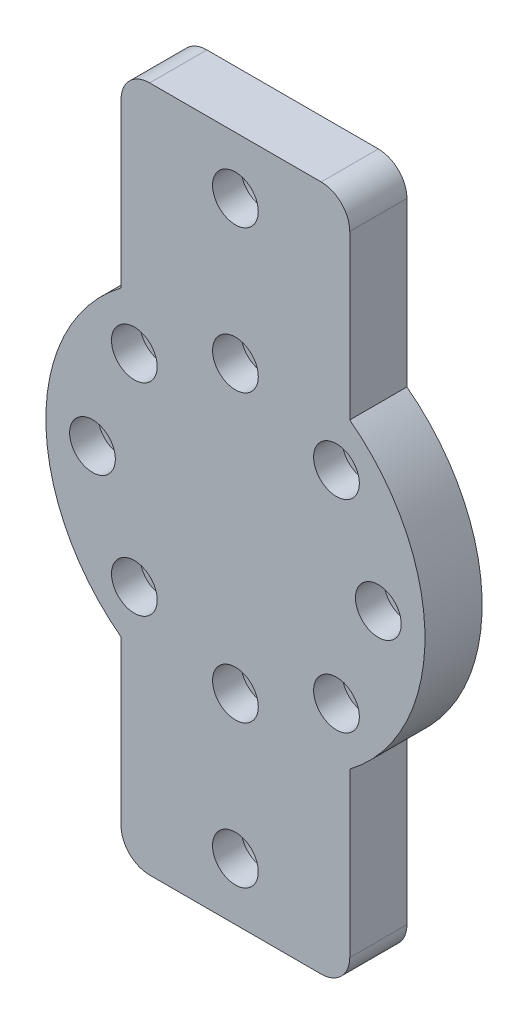
from build123d import *

# Parameters (mm, degrees)
MODEL_R                 = 2.6
MODEL_R_2               = 4
SALIENTE_EXTRUIR1_DEPTH = 10
CROQUIS3_R              = 4
CORTAR_EXTRUIR1_DEPTH   = 5
CROQUIS4_R              = 7
CORTAR_EXTRUIR2_DEPTH   = 5


with BuildPart() as part:
    # Model → Saliente-Extruir1 (new body)
    with BuildSketch(Plane.XY):
        with BuildLine():
            Line((-15, 60), (15, 60))
            ThreePointArc((15, 60), (18.535533906, 58.535533906), (20, 55))
            Line((20, 55), (20, 26.442576537))
            ThreePointArc((20, 26.442576537), (33.154333863, 0), (20, -26.442576537))
            Line((20, -26.442576537), (20, -55))
            ThreePointArc((20, -55), (18.535533906, -58.535533906), (15, -60))
            Line((15, -60), (-15.011202946, -60))
            ThreePointArc((-15.011202946, -60), (-18.663093033, -58.415215776), (-20, -54.665479518))
            Line((-20, -54.665479518), (-20, -26.442576537))
            ThreePointArc((-20, -26.442576537), (-33.154333863, 0), (-20, 26.442576537))
            Line((-20, 26.442576537), (-20, 55))
            ThreePointArc((-20, 55), (-18.535533906, 58.535533906), (-15, 60))
        make_face()
        with Locations((-17.67766953, 17.677669526)):
            Circle(MODEL_R, mode=Mode.SUBTRACT)
        with Locations((-2e-09, 24.999999998)):
            Circle(MODEL_R, mode=Mode.SUBTRACT)
        with Locations((-24.999999998, -2e-09)):
            Circle(MODEL_R, mode=Mode.SUBTRACT)
        with Locations((17.677669526, 17.67766953)):
            Circle(MODEL_R, mode=Mode.SUBTRACT)
        with Locations((24.999999998, 2e-09)):
            Circle(MODEL_R, mode=Mode.SUBTRACT)
        with Locations((17.67766953, -17.677669526)):
            Circle(MODEL_R, mode=Mode.SUBTRACT)
        with Locations((2e-09, -24.999999998)):
            Circle(MODEL_R, mode=Mode.SUBTRACT)
        with Locations((-17.677669526, -17.67766953)):
            Circle(MODEL_R, mode=Mode.SUBTRACT)
        with Locations((0, 50)):
            Circle(MODEL_R_2, mode=Mode.SUBTRACT)
        with Locations(Location((0, -50, 0), (0, 0, 180))):
            Circle(MODEL_R_2, mode=Mode.SUBTRACT)
    extrude(amount=SALIENTE_EXTRUIR1_DEPTH)

    # Croquis3 → Cortar-Extruir1 (cut)
    with BuildSketch(Plane.XY.offset(10)):
        with Locations((24.999999998, 2e-09)):
            Circle(CROQUIS3_R)
        with Locations((17.67766953, -17.677669526)):
            Circle(CROQUIS3_R)
        with Locations((2e-09, -24.999999998)):
            Circle(CROQUIS3_R)
        with Locations((-17.677669526, -17.67766953)):
            Circle(CROQUIS3_R)
        with Locations((-24.999999998, -2e-09)):
            Circle(CROQUIS3_R)
        with Locations((-17.67766953, 17.677669526)):
            Circle(CROQUIS3_R)
        with Locations((-2e-09, 24.999999998)):
            Circle(CROQUIS3_R)
        with Locations((17.677669526, 17.67766953)):
            Circle(CROQUIS3_R)
    extrude(amount=-CORTAR_EXTRUIR1_DEPTH, mode=Mode.SUBTRACT)

    # Croquis4 → Cortar-Extruir2 (cut)
    with BuildSketch(Plane(origin=(0, 0, 0), x_dir=(-1, 0, 0), z_dir=(0, 0, -1))):
        with Locations((0, 50)):
            Circle(CROQUIS4_R)
        with Locations(Location((0, -50, 0), (0, 0, 180))):
            Circle(CROQUIS4_R)
    extrude(amount=-CORTAR_EXTRUIR2_DEPTH, mode=Mode.SUBTRACT)


solid = part.part
